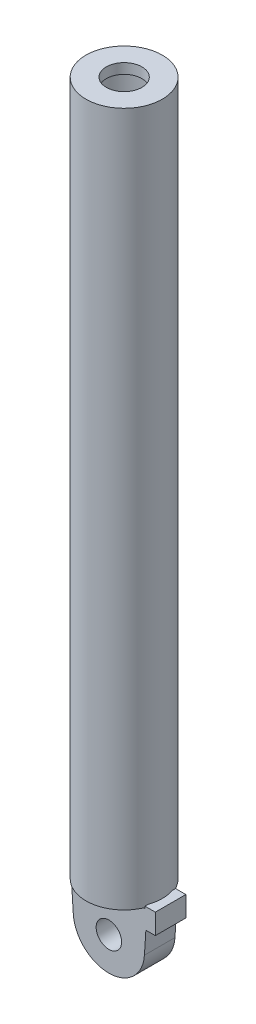
from build123d import *

# Parameters (mm, degrees)
SKETCH1_R           = 12.5
BOSS_EXTRUDE1_DEPTH = 15


with BuildPart() as part:
    # Sketch1 → Boss-Extrude1 (new, symmetric)
    with BuildSketch(Plane.XY):
        with BuildLine():
            Line((37.628606884, 42), (35.5, 42))
            Line((35.5, 42), (35.5, 40))
            Line((35.5, 40), (-37.5, 40))
            Line((-37.5, 40), (-34.927862315, 0))
            ThreePointArc((-34.927862315, 0), (0, -32.754018227), (34.927862315, 0))
            Line((34.927862315, 0), (36.342538042, 22))
            Line((36.342538042, 22), (45.628606884, 22))
            Line((45.628606884, 22), (45.628606884, 42))
            Line((45.628606884, 42), (37.628606884, 42))
        make_face()
        Circle(SKETCH1_R, mode=Mode.SUBTRACT)
    extrude(amount=BOSS_EXTRUDE1_DEPTH, both=True)

    # Sketch2 → Revolve1 (revolve)
    with BuildSketch(Plane.XY):
        Polygon((-37.5, 722), (-17.5, 722), (-17.5, 712), (-32.5, 712), (-32.5, 172), (0, 172), (0, 40), (-37.5, 40), align=None)
    revolve(axis=Axis((0, 722, 0), (0, -1, 0)))


solid = part.part
